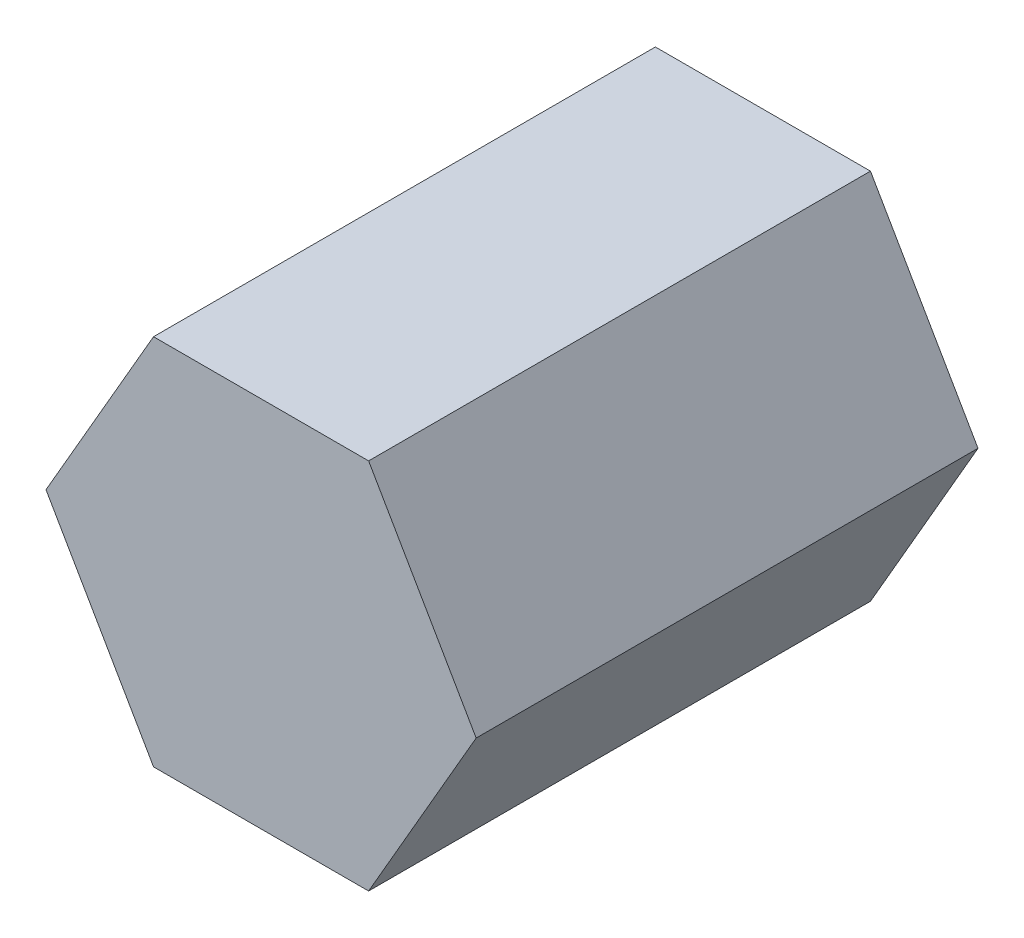
from build123d import *

# Parameters (mm, degrees)
BOSS_EXTRUDE1_DEPTH = 7


with BuildPart() as part:
    # Sketch1 → Boss-Extrude1 (new body)
    with BuildSketch(Plane.XY):
        Polygon((1.5, -2.598076211), (3, 0), (1.5, 2.598076211), (-1.5, 2.598076211), (-3, 0), (-1.5, -2.598076211), align=None)
    extrude(amount=BOSS_EXTRUDE1_DEPTH)


solid = part.part
